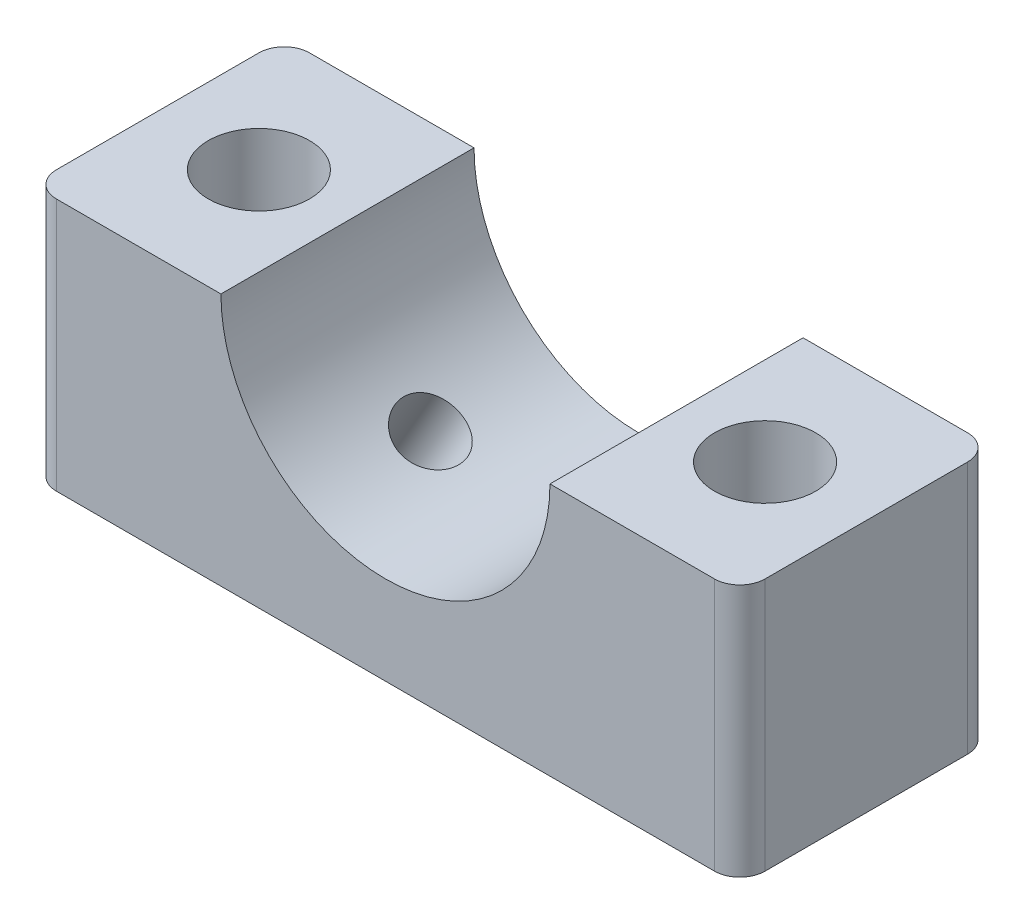
from build123d import *

# Parameters (mm, degrees)
BOSS_EXTRUDE1_DEPTH = 5
CUT_EXTRUDE1_REACH  = 19.916
SKETCH4_R           = 2
FILLET1_R           = 1


with BuildPart() as part:
    # Sketch1 → Boss-Extrude1 (new, symmetric)
    with BuildSketch(Plane.XY):
        with BuildLine():
            Line((-14, 0), (14, 0))
            Line((14, 0), (14, 10))
            Line((14, 10), (6.5, 10))
            ThreePointArc((6.5, 10), (0, 3.5), (-6.5, 10))
            Line((-6.5, 10), (-14, 10))
            Line((-14, 10), (-14, 0))
        make_face()
    extrude(amount=BOSS_EXTRUDE1_DEPTH, both=True)

    # Sketch2 → Cut-Revolve2 (revolve, cut)
    with BuildSketch(Plane.XY):
        Polygon((-2.748441557, 5.239559582), (-7.60591541, -3.173831928), (-8.688447164, -2.548831928), (-3.830973311, 5.864559582), align=None)
    revolve(axis=Axis((-2.748441557, 5.239559582, 0), (-0.4999999999999947, -0.8660254037844417, 0)), mode=Mode.SUBTRACT)

    # Sketch4 → Cut-Extrude1 (cut, up to next)
    with BuildSketch(Plane(origin=(0, 10, 0), x_dir=(1, 0, 0), z_dir=(0, 1, 0)), mode=Mode.PRIVATE) as cut_extrude1_sk1:
        with Locations(Location((-10, 0, 0), (0, 0, 270))):
            Circle(SKETCH4_R)
    cut_extrude1_tool1 = extrude(cut_extrude1_sk1.sketch, amount=-CUT_EXTRUDE1_REACH, mode=Mode.PRIVATE) & part.part
    # Sketch4 → Cut-Extrude1 (cut, up to next)
    with BuildSketch(Plane(origin=(0, 10, 0), x_dir=(1, 0, 0), z_dir=(0, 1, 0)), mode=Mode.PRIVATE) as cut_extrude1_sk2:
        with Locations(Location((10, 0, 0), (0, 0, 270))):
            Circle(SKETCH4_R)
    cut_extrude1_tool2 = extrude(cut_extrude1_sk2.sketch, amount=-CUT_EXTRUDE1_REACH, mode=Mode.PRIVATE) & part.part
    add(cut_extrude1_tool1.solids().sort_by_distance((-10, 10, 0))[0], mode=Mode.SUBTRACT)
    add(cut_extrude1_tool2.solids().sort_by_distance((10, 10, 0))[0], mode=Mode.SUBTRACT)

    # Fillet1
    fillet1_edges = [part.edges().sort_by_distance(p)[0] for p in [
        (14, 5, 5),
        (-14, 5, 5),
        (14, 5, -5),
        (-14, 5, -5),
    ]]
    fillet(fillet1_edges, radius=FILLET1_R)


solid = part.part
